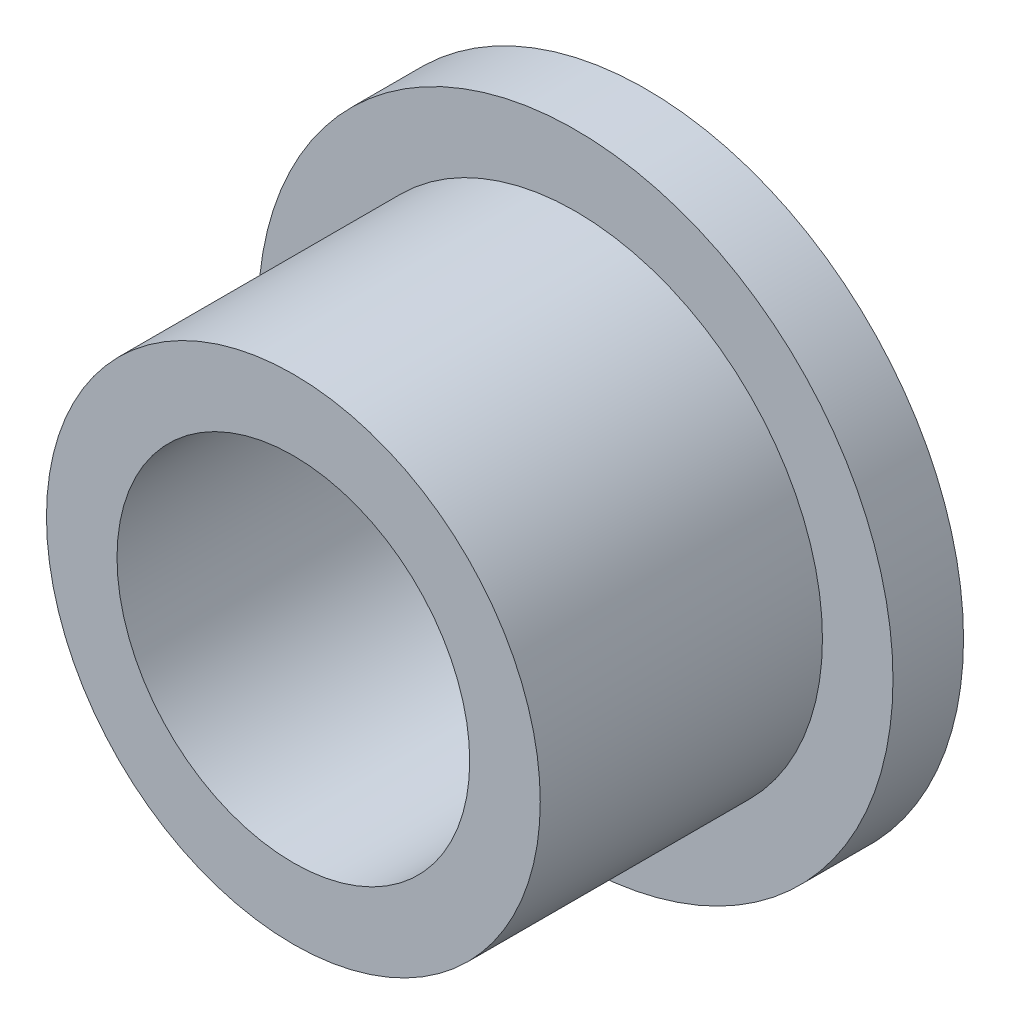
from build123d import *

# Parameters (mm, degrees)
SKETCH_1_R      = 17.5
SKETCH_1_R_2    = 12.5
EXTRUDE_1_DEPTH = 20
EXTRUDE_START   = -5
SKETCH_1_3_R    = 22.5
SKETCH_1_3_R_2  = 12.5
EXTRUDE_2_DEPTH = 5


with BuildPart() as part:
    # 草图1 → 凸台-拉伸1 (new body)
    with BuildSketch(Plane.XY):
        Circle(SKETCH_1_R)
        Circle(SKETCH_1_R_2, mode=Mode.SUBTRACT)
    extrude(amount=EXTRUDE_1_DEPTH)

    # 草图1<3> → 凸台-拉伸2 (add)
    with BuildSketch(Plane.XY.offset(EXTRUDE_START)):
        Circle(SKETCH_1_3_R)
        Circle(SKETCH_1_3_R_2, mode=Mode.SUBTRACT)
    extrude(amount=EXTRUDE_2_DEPTH)


solid = part.part
